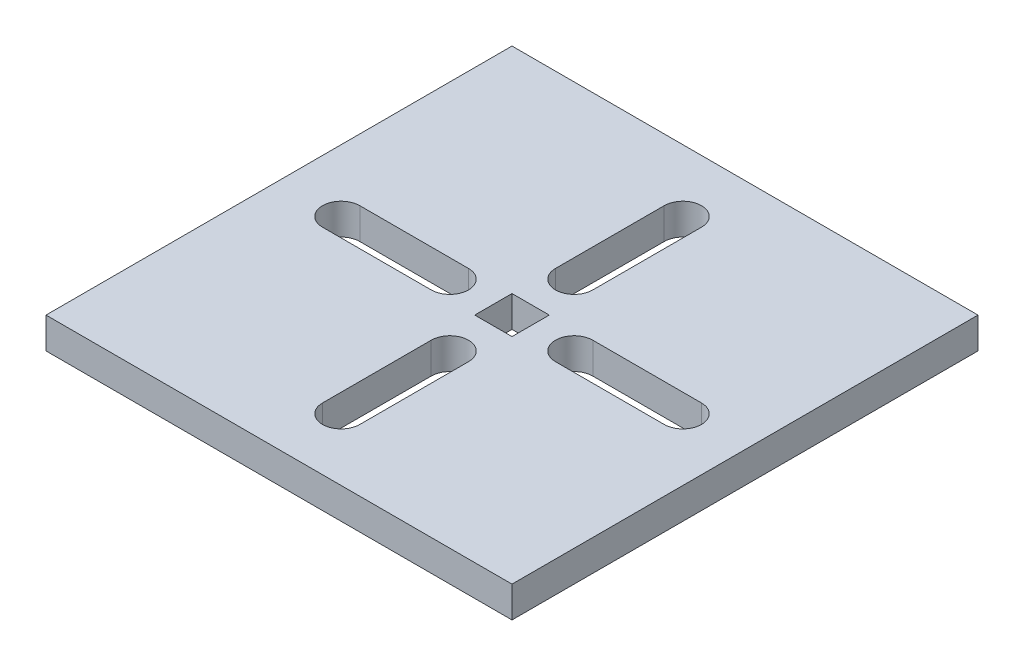
from build123d import *

# Parameters (mm, degrees)
SKETCH1_W           = 150
SKETCH1_H           = 150
BOSS_EXTRUDE1_DEPTH = 10
SKETCH3_W           = 12
SKETCH3_H           = 12
CUT_EXTRUDE2_DEPTH  = 107.536378763
CUT_EXTRUDE1_DEPTH  = 107.536378763
CIRPATTERN1_COUNT   = 4


with BuildPart() as part:
    # Sketch1 → Boss-Extrude1 (new body)
    with BuildSketch(Plane(origin=(0, 0, 0), x_dir=(1, 0, 0), z_dir=(0, 1, 0))):
        Rectangle(SKETCH1_W, SKETCH1_H)
    extrude(amount=BOSS_EXTRUDE1_DEPTH)

    # Sketch3 → Cut-Extrude2 (cut, through all)
    with BuildSketch(Plane(origin=(0, 10, 0), x_dir=(1, 0, 0), z_dir=(0, 1, 0))):
        Rectangle(SKETCH3_W, SKETCH3_H)
    extrude(amount=-CUT_EXTRUDE2_DEPTH, mode=Mode.SUBTRACT)

    # Sketch2 → Cut-Extrude1 (cut, through all)
    with BuildSketch(Plane(origin=(0, 10, 0), x_dir=(1, 0, 0), z_dir=(0, 1, 0))):
        with BuildLine():
            Line((20, 6), (55, 6))
            ThreePointArc((55, 6), (61, 0), (55, -6))
            Line((55, -6), (20, -6))
            ThreePointArc((20, -6), (14, 0), (20, 6))
        make_face()
    cut_extrude1 = extrude(amount=-CUT_EXTRUDE1_DEPTH, mode=Mode.SUBTRACT)

    # CirPattern1: Cut-Extrude1 ×4 about axis
    cirpattern1_axis = Axis((0, -0.5, 0), (0, 1, 0))
    for i in range(1, CIRPATTERN1_COUNT):
        add(cut_extrude1.rotate(cirpattern1_axis, i * 360 / CIRPATTERN1_COUNT), mode=Mode.SUBTRACT)


solid = part.part
